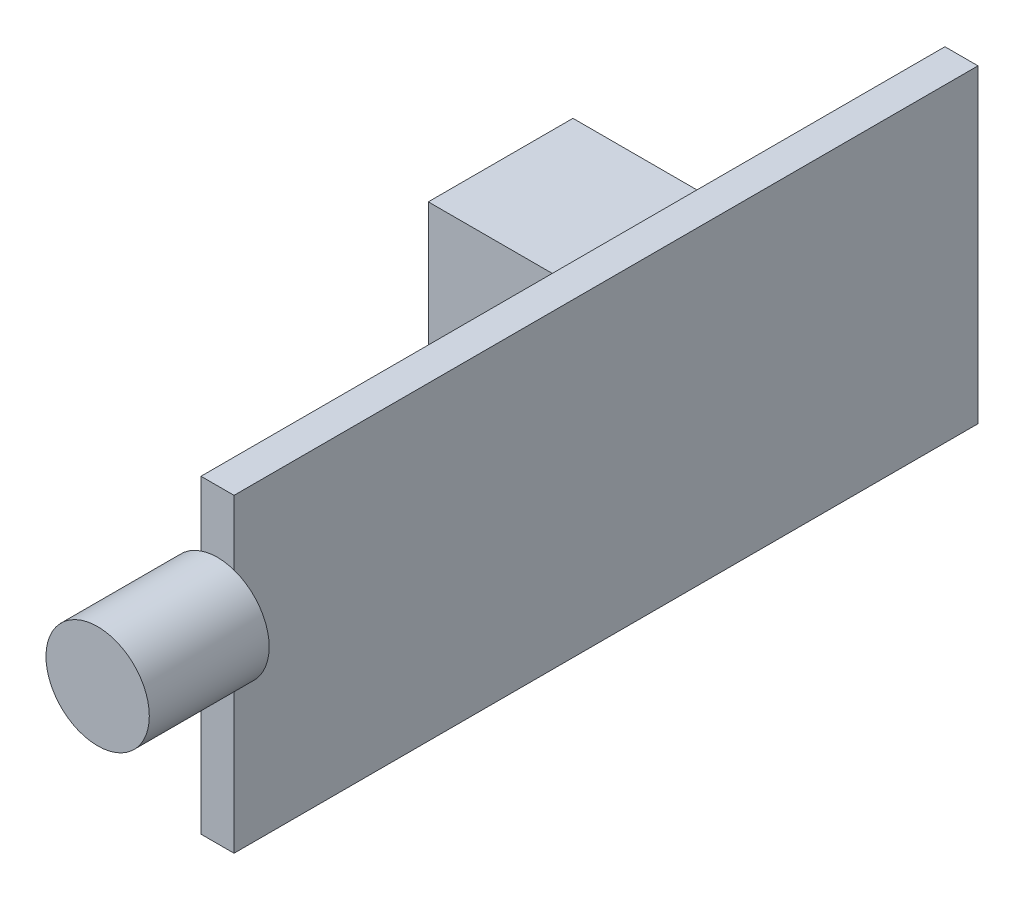
from build123d import *

# Parameters (mm, degrees)
SKETCH1_W           = 1.6
SKETCH1_H           = 15
BOSS_EXTRUDE1_DEPTH = 36
SKETCH2_R           = 2.5
BOSS_EXTRUDE2_DEPTH = 5.8
SKETCH3_W           = 7
SKETCH3_H           = 6
BOSS_EXTRUDE3_DEPTH = 7


with BuildPart() as part:
    # Sketch1 → Boss-Extrude1 (new body)
    with BuildSketch(Plane.XY.offset(7)):
        with Locations((15, -121)):
            Rectangle(SKETCH1_W, SKETCH1_H)
    extrude(amount=BOSS_EXTRUDE1_DEPTH)

    # Sketch2 → Boss-Extrude2 (add)
    with BuildSketch(Plane.XY.offset(43)):
        with Locations(Location((15, -119, 0), (0, 0, 108.662924885))):
            Circle(SKETCH2_R)
    extrude(amount=BOSS_EXTRUDE2_DEPTH)

    # Sketch3 → Boss-Extrude3 (add)
    with BuildSketch(Plane.XY.offset(18)):
        with Locations((10.7, -117.5)):
            Rectangle(SKETCH3_W, SKETCH3_H)
    extrude(amount=BOSS_EXTRUDE3_DEPTH)


solid = part.part
